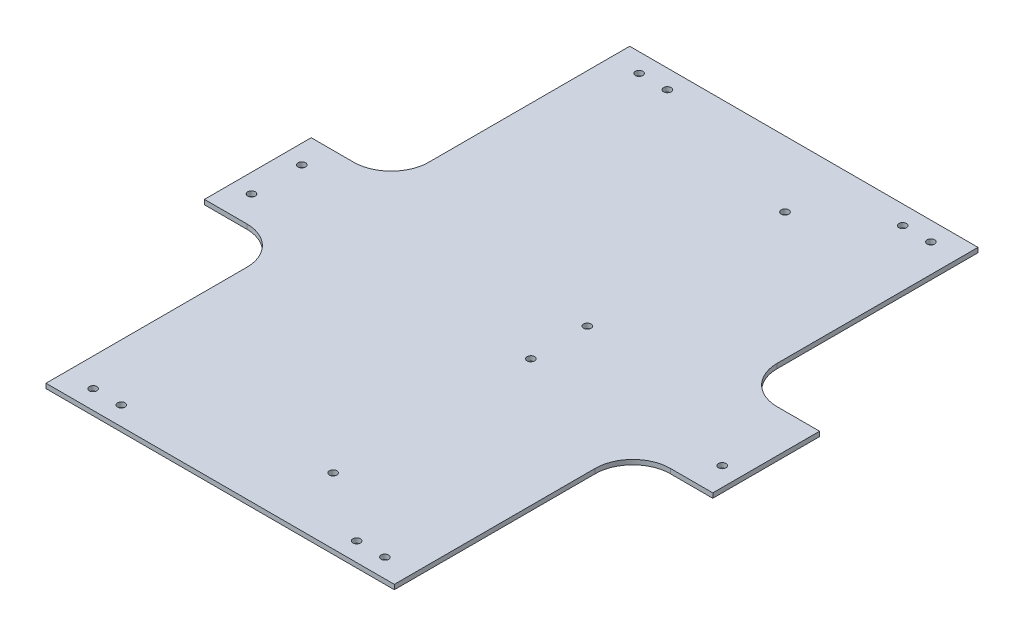
from build123d import *

# Parameters (mm, degrees)
SKETCH2_R           = 4
BOSS_EXTRUDE1_DEPTH = 5
FILLET1_R           = 40


with BuildPart() as part:
    # Sketch2 → Boss-Extrude1 (new body)
    with BuildSketch(Plane(origin=(0, -112.700994014, 0), x_dir=(1, 0, 0), z_dir=(0, 1, 0))):
        Polygon((271.436244825, 21.453222376), (186.436244825, 21.453222376), (186.436244825, 274.737493623), (-183.563755175, 274.737493623), (-183.563755175, 21.453222376), (-268.563755175, 21.453222376), (-268.563755175, -91.978235129), (-183.563755175, -91.978235129), (-183.563755175, -345.262506377), (186.436244825, -345.262506377), (186.436244825, -91.978235129), (271.436244825, -91.978235129), align=None)
        with Locations(Location((156.436244825, -325.262506377, 0), (0, 0, 270))):
            Circle(SKETCH2_R, mode=Mode.SUBTRACT)
        with Locations(Location((126.436244825, -325.262506377, 0), (0, 0, 270))):
            Circle(SKETCH2_R, mode=Mode.SUBTRACT)
        with Locations(Location((251.436244825, -61.978235129, 0), (0, 0, 270))):
            Circle(SKETCH2_R, mode=Mode.SUBTRACT)
        with Locations(Location((-153.563755175, -325.262506377, 0), (0, 0, 270))):
            Circle(SKETCH2_R, mode=Mode.SUBTRACT)
        with Locations(Location((-123.563755175, -325.262506377, 0), (0, 0, 270))):
            Circle(SKETCH2_R, mode=Mode.SUBTRACT)
        with Locations(Location((-248.563755175, -61.978235129, 0), (0, 0, 270))):
            Circle(SKETCH2_R, mode=Mode.SUBTRACT)
        with Locations(Location((51.436244825, -275.262506377, 0), (0, 0, 270))):
            Circle(SKETCH2_R, mode=Mode.SUBTRACT)
        with Locations(Location((51.436244825, -65.262506377, 0), (0, 0, 270))):
            Circle(SKETCH2_R, mode=Mode.SUBTRACT)
        with Locations(Location((51.436244825, -5.262506377, 0), (0, 0, 90))):
            Circle(SKETCH2_R, mode=Mode.SUBTRACT)
        with Locations(Location((51.436244825, 204.737493623, 0), (0, 0, 90))):
            Circle(SKETCH2_R, mode=Mode.SUBTRACT)
        with Locations(Location((-248.563755175, -8.546777624, 0), (0, 0, 90))):
            Circle(SKETCH2_R, mode=Mode.SUBTRACT)
        with Locations(Location((-123.563755175, 254.737493623, 0), (0, 0, 90))):
            Circle(SKETCH2_R, mode=Mode.SUBTRACT)
        with Locations(Location((-153.563755175, 254.737493623, 0), (0, 0, 90))):
            Circle(SKETCH2_R, mode=Mode.SUBTRACT)
        with Locations(Location((126.436244825, 254.737493623, 0), (0, 0, 90))):
            Circle(SKETCH2_R, mode=Mode.SUBTRACT)
        with Locations(Location((156.436244825, 254.737493623, 0), (0, 0, 90))):
            Circle(SKETCH2_R, mode=Mode.SUBTRACT)
    extrude(amount=BOSS_EXTRUDE1_DEPTH)

    # Fillet1
    fillet1_edges = [part.edges().sort_by_distance(p)[0] for p in [
        (186.436244825, -110.200994014, -21.453222376),
        (186.436244825, -110.200994014, 91.978235129),
        (-183.563755175, -110.200994014, 91.978235129),
        (-183.563755175, -110.200994014, -21.453222376),
    ]]
    fillet(fillet1_edges, radius=FILLET1_R)


solid = part.part
